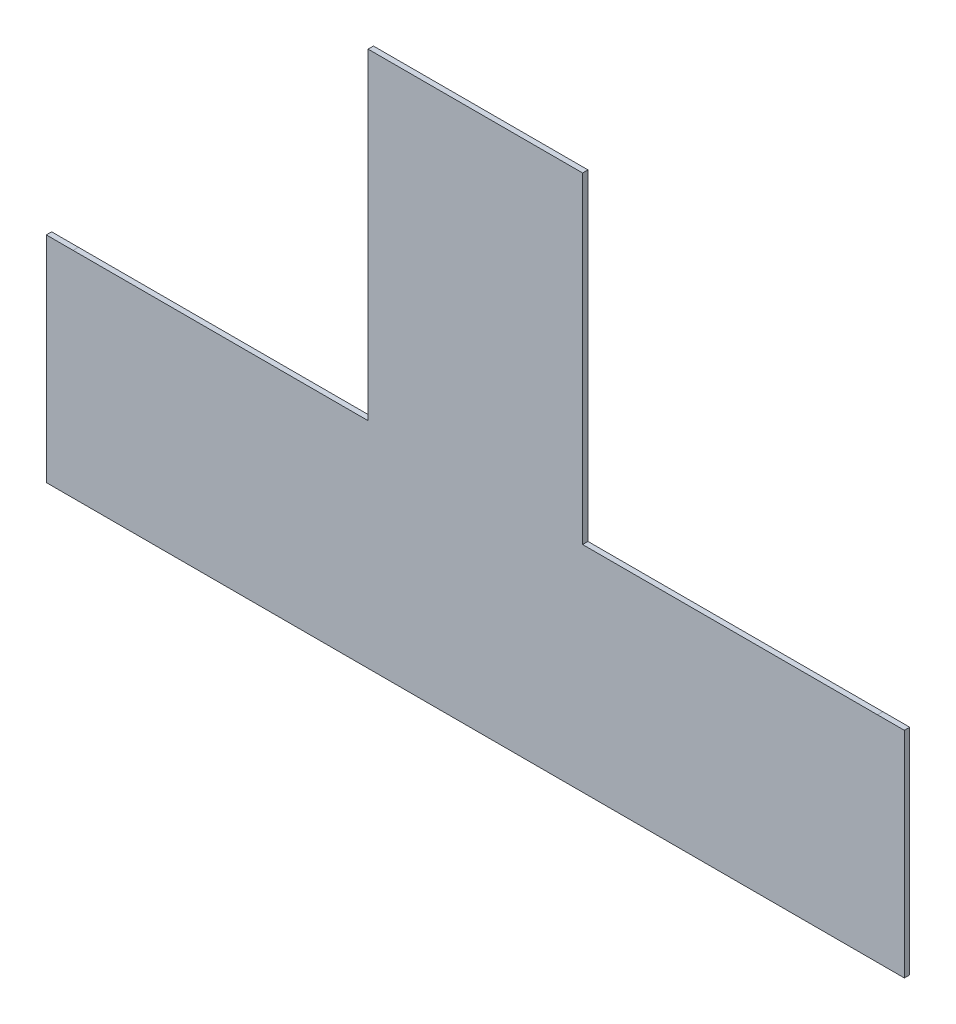
from build123d import *

# Parameters (mm, degrees)
BOSS_EXTRUDE1_DEPTH = 10


with BuildPart() as part:
    # Sketch1 → Boss-Extrude1 (new body)
    with BuildSketch(Plane.XY):
        Polygon((800, 0), (800, 1000), (600, 1000), (600, 400), (0, 400), (0, 0), align=None)
        Polygon((1000, 1000), (800, 1000), (800, 0), (1600, 0), (1600, 400), (1000, 400), align=None)
    extrude(amount=BOSS_EXTRUDE1_DEPTH)


solid = part.part
